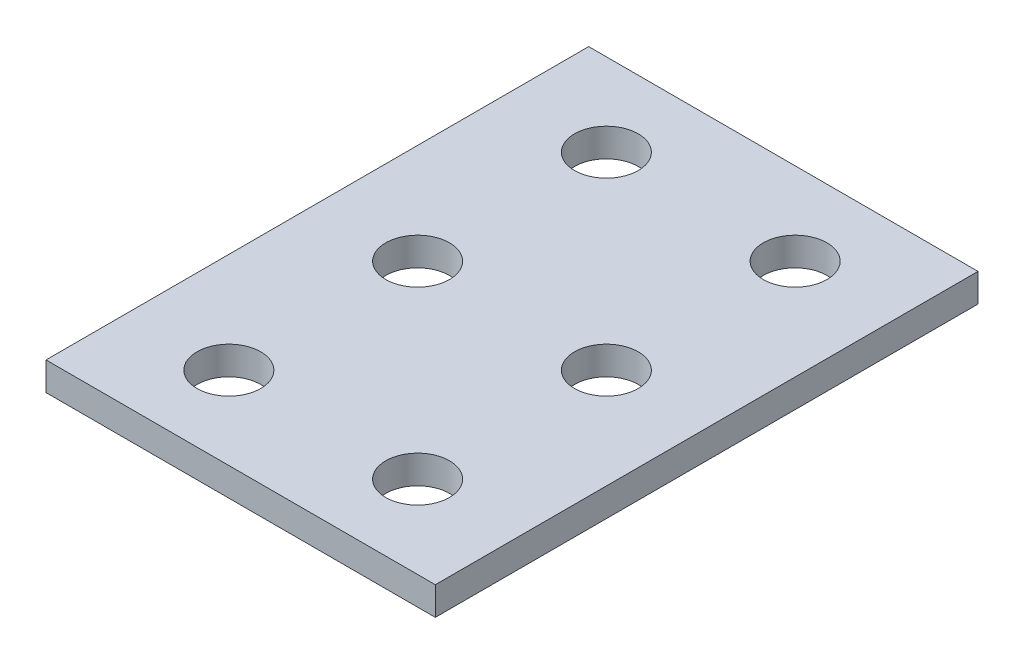
from build123d import *

# Parameters (mm, degrees)
SKETCH_3_W          = 165
SKETCH_3_H          = 230
EXTRUDE_2_DEPTH     = 12
SKETCH_4_R          = 13.5
CUT_EXTRUDE_2_DEPTH = 284.317842714


with BuildPart() as part:
    # 草图3 → 凸台-拉伸2 (new body)
    with BuildSketch(Plane(origin=(0, 0, 0), x_dir=(1, 0, 0), z_dir=(0, 1, 0))):
        with Locations((82.5, 115)):
            Rectangle(SKETCH_3_W, SKETCH_3_H)
    extrude(amount=EXTRUDE_2_DEPTH)

    # 草图4 → 切除-拉伸2 (cut, through all)
    with BuildSketch(Plane(origin=(0, 12, 0), x_dir=(1, 0, 0), z_dir=(0, 1, 0))):
        with Locations(Location((42.5, 195, 0), (0, 0, 270))):
            Circle(SKETCH_4_R)
        with Locations(Location((122.5, 195, 0), (0, 0, 270))):
            Circle(SKETCH_4_R)
        with Locations(Location((42.5, 115, 0), (0, 0, 270))):
            Circle(SKETCH_4_R)
        with Locations(Location((122.5, 115, 0), (0, 0, 270))):
            Circle(SKETCH_4_R)
        with Locations(Location((42.5, 35, 0), (0, 0, 270))):
            Circle(SKETCH_4_R)
        with Locations(Location((122.5, 35, 0), (0, 0, 270))):
            Circle(SKETCH_4_R)
    extrude(amount=-CUT_EXTRUDE_2_DEPTH, mode=Mode.SUBTRACT)


solid = part.part
